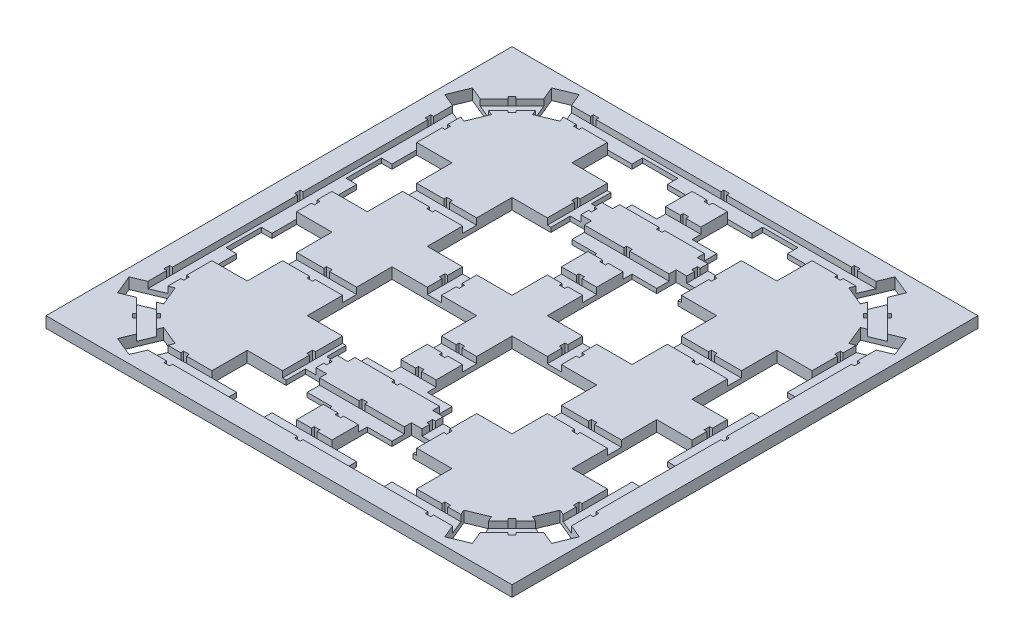
from build123d import *

# Parameters (mm, degrees)
SKETCH_1_W          = 660
SKETCH_1_H          = 660
EXTRUDE_1_DEPTH     = 15.5
SKETCH_2_W          = 150
SKETCH_2_H          = 37.5
SKETCH_2_W_2        = 185
SKETCH_2_H_2        = 150
SKETCH_2_H_3        = 50
CUT_EXTRUDE_1_DEPTH = 9
SKETCH_3_W          = 50
SKETCH_3_H          = 30
SKETCH_3_W_2        = 30
SKETCH_3_H_2        = 50
CUT_EXTRUDE_2_DEPTH = 467.947802222
SKETCH_4_W          = 50
SKETCH_4_H          = 120
SKETCH_4_W_2        = 120
SKETCH_4_H_2        = 50
CUT_EXTRUDE_3_DEPTH = 467.947802222
SKETCH_6_W          = 8
SKETCH_6_H          = 4
SKETCH_6_W_2        = 4
SKETCH_6_H_2        = 8
CUT_EXTRUDE_4_DEPTH = 467.947802222


with BuildPart() as part:
    # 草图1 → 凸台-拉伸1 (new body)
    with BuildSketch(Plane(origin=(0, 0, 0), x_dir=(1, 0, 0), z_dir=(0, 1, 0))):
        Rectangle(SKETCH_1_W, SKETCH_1_H)
    extrude(amount=EXTRUDE_1_DEPTH)

    # 草图2 → 切除-拉伸1 (cut)
    with BuildSketch(Plane(origin=(0, 15.5, 0), x_dir=(1, 0, 0), z_dir=(0, 1, 0))):
        Polygon((-300, 212), (-300, -232), (-232, -300), (232, -300), (300, -232), (300, 212), (300, 232), (232, 300), (212, 300), (-212, 300), (-232, 300), (-300, 232), align=None)
        Polygon((-280, 223.715728753), (-280, 95), (-95, 95), (-95, 280), (-223.715728753, 280), align=None, mode=Mode.SUBTRACT)
        Polygon((280, 223.715728753), (223.715728753, 280), (95, 280), (95, 95), (280, 95), align=None, mode=Mode.SUBTRACT)
        Polygon((280, -223.715728753), (223.715728753, -280), (95, -280), (95, -95), (280, -95), align=None, mode=Mode.SUBTRACT)
        Polygon((-223.715728753, -280), (-95, -280), (-95, -95), (-280, -95), (-280, -223.715728753), align=None, mode=Mode.SUBTRACT)
        with Locations((0, 261.25)):
            Rectangle(SKETCH_2_W, SKETCH_2_H, mode=Mode.SUBTRACT)
        with Locations((-187.5, 0)):
            Rectangle(SKETCH_2_W_2, SKETCH_2_H_2, mode=Mode.SUBTRACT)
        with Locations((0, 113.75)):
            Rectangle(SKETCH_2_W, SKETCH_2_H, mode=Mode.SUBTRACT)
        Rectangle(SKETCH_2_W, SKETCH_2_H_2, mode=Mode.SUBTRACT)
        with Locations((187.5, 0)):
            Rectangle(SKETCH_2_W_2, SKETCH_2_H_2, mode=Mode.SUBTRACT)
        with Locations((0, -113.75)):
            Rectangle(SKETCH_2_W, SKETCH_2_H, mode=Mode.SUBTRACT)
        with Locations((0, -261.25)):
            Rectangle(SKETCH_2_W, SKETCH_2_H, mode=Mode.SUBTRACT)
        with Locations((0, 187.5)):
            Rectangle(SKETCH_2_W, SKETCH_2_H_3, mode=Mode.SUBTRACT)
        with Locations((0, -187.5)):
            Rectangle(SKETCH_2_W, SKETCH_2_H_3, mode=Mode.SUBTRACT)
    extrude(amount=-CUT_EXTRUDE_1_DEPTH, mode=Mode.SUBTRACT)

    # 草图3 → 切除-拉伸2 (cut, through all)
    with BuildSketch(Plane(origin=(0, 15.5, 0), x_dir=(1, 0, 0), z_dir=(0, 1, 0))):
        Polygon((-251.283143173, 307.356736827), (-232.148971555, 261.162760202), (-204.432585579, 272.643263173), (-223.566757198, 318.837239798), align=None)
        with Locations((-85, 280)):
            Rectangle(SKETCH_3_W, SKETCH_3_H)
        with Locations((-280, 85)):
            Rectangle(SKETCH_3_W_2, SKETCH_3_H_2)
        with Locations((-85, 85)):
            Rectangle(SKETCH_3_W, SKETCH_3_H_2)
        Polygon((-261.162760202, 232.148971555), (-272.643263173, 204.432585579), (-318.837239798, 223.566757198), (-307.356736827, 251.283143173), align=None)
        with Locations((85, 85)):
            Rectangle(SKETCH_3_W, SKETCH_3_H_2)
        with Locations((85, 280)):
            Rectangle(SKETCH_3_W, SKETCH_3_H)
        Polygon((232.148971555, 261.162760202), (204.432585579, 272.643263173), (223.566757198, 318.837239798), (251.283143173, 307.356736827), align=None)
        Polygon((307.356736827, 251.283143173), (261.162760202, 232.148971555), (272.643263173, 204.432585579), (318.837239798, 223.566757198), align=None)
        with Locations((280, 85)):
            Rectangle(SKETCH_3_W_2, SKETCH_3_H_2)
        with Locations((280, -85)):
            Rectangle(SKETCH_3_W_2, SKETCH_3_H_2)
        Polygon((261.162760202, -232.148971555), (272.643263173, -204.432585579), (318.837239798, -223.566757198), (307.356736827, -251.283143173), align=None)
        Polygon((251.283143173, -307.356736827), (232.148971555, -261.162760202), (204.432585579, -272.643263173), (223.566757198, -318.837239798), align=None)
        with Locations((85, -280)):
            Rectangle(SKETCH_3_W, SKETCH_3_H)
        with Locations((85, -85)):
            Rectangle(SKETCH_3_W, SKETCH_3_H_2)
        Polygon((-307.356736827, -251.283143173), (-261.162760202, -232.148971555), (-272.643263173, -204.432585579), (-318.837239798, -223.566757198), align=None)
        with Locations((-280, -85)):
            Rectangle(SKETCH_3_W_2, SKETCH_3_H_2)
        with Locations((-85, -85)):
            Rectangle(SKETCH_3_W, SKETCH_3_H_2)
        with Locations((-85, -280)):
            Rectangle(SKETCH_3_W, SKETCH_3_H)
        Polygon((-223.566757198, -318.837239798), (-204.432585579, -272.643263173), (-232.148971555, -261.162760202), (-251.283143173, -307.356736827), align=None)
        with Locations((75, 227.5)):
            Rectangle(SKETCH_3_W_2, SKETCH_3_H_2)
        with Locations((-75, 227.5)):
            Rectangle(SKETCH_3_W_2, SKETCH_3_H_2)
        with Locations((75, -227.5)):
            Rectangle(SKETCH_3_W_2, SKETCH_3_H_2)
        with Locations((-75, -227.5)):
            Rectangle(SKETCH_3_W_2, SKETCH_3_H_2)
        with Locations((75, 147.5)):
            Rectangle(SKETCH_3_W_2, SKETCH_3_H_2)
        with Locations((-75, 147.5)):
            Rectangle(SKETCH_3_W_2, SKETCH_3_H_2)
        with Locations((75, -147.5)):
            Rectangle(SKETCH_3_W_2, SKETCH_3_H_2)
        with Locations((-75, -147.5)):
            Rectangle(SKETCH_3_W_2, SKETCH_3_H_2)
    extrude(amount=-CUT_EXTRUDE_2_DEPTH, mode=Mode.SUBTRACT)

    # 草图4 → 切除-拉伸3 (cut, through all)
    with BuildSketch(Plane(origin=(0, 15.5, 0), x_dir=(1, 0, 0), z_dir=(0, 1, 0))):
        with Locations((-255, 85)):
            Rectangle(SKETCH_4_W, SKETCH_4_H)
        with Locations((-85, 255)):
            Rectangle(SKETCH_4_W_2, SKETCH_4_H_2)
        with Locations((-85, 85)):
            Rectangle(SKETCH_4_W_2, SKETCH_4_H)
        with Locations((85, 85)):
            Rectangle(SKETCH_4_W_2, SKETCH_4_H)
        with Locations((85, 255)):
            Rectangle(SKETCH_4_W_2, SKETCH_4_H_2)
        with Locations((255, 85)):
            Rectangle(SKETCH_4_W, SKETCH_4_H)
        with Locations((255, -85)):
            Rectangle(SKETCH_4_W, SKETCH_4_H)
        with Locations((85, -255)):
            Rectangle(SKETCH_4_W_2, SKETCH_4_H_2)
        with Locations((85, -85)):
            Rectangle(SKETCH_4_W_2, SKETCH_4_H)
        with Locations((-85, -255)):
            Rectangle(SKETCH_4_W_2, SKETCH_4_H_2)
        with Locations((-85, -85)):
            Rectangle(SKETCH_4_W_2, SKETCH_4_H)
        with Locations((-255, -85)):
            Rectangle(SKETCH_4_W, SKETCH_4_H)
    extrude(amount=-CUT_EXTRUDE_3_DEPTH, mode=Mode.SUBTRACT)

    # 草图6 → 切除-拉伸4 (cut, through all)
    with BuildSketch(Plane(origin=(0, 15.5, 0), x_dir=(1, 0, 0), z_dir=(0, 1, 0))):
        with Locations((185, -302)):
            Rectangle(SKETCH_6_W, SKETCH_6_H)
        with Locations((278, -185)):
            Rectangle(SKETCH_6_W_2, SKETCH_6_H_2)
        with Locations((0, -302)):
            Rectangle(SKETCH_6_W, SKETCH_6_H)
        with Locations((0, -278)):
            Rectangle(SKETCH_6_W, SKETCH_6_H)
        with Locations((-185, -302)):
            Rectangle(SKETCH_6_W, SKETCH_6_H)
        with Locations((-185, -278)):
            Rectangle(SKETCH_6_W, SKETCH_6_H)
        Polygon((-251.857864376, -246.201010127), (-246.201010127, -251.857864376), (-249.029437252, -254.686291501), (-254.686291501, -249.029437252), align=None)
        Polygon((-268.828427125, -263.171572875), (-271.656854249, -266), (-266, -271.65685425), (-263.171572875, -268.828427125), align=None)
        with Locations((-302, -185)):
            Rectangle(SKETCH_6_W_2, SKETCH_6_H_2)
        with Locations((-97, -187.5)):
            Rectangle(SKETCH_6_W_2, SKETCH_6_H_2)
        with Locations((0, -210.5)):
            Rectangle(SKETCH_6_W, SKETCH_6_H)
        with Locations((0, -164.5)):
            Rectangle(SKETCH_6_W, SKETCH_6_H)
        with Locations((73, -187.5)):
            Rectangle(SKETCH_6_W_2, SKETCH_6_H_2)
        with Locations((97, -187.5)):
            Rectangle(SKETCH_6_W_2, SKETCH_6_H_2)
        with Locations((187.5, -97)):
            Rectangle(SKETCH_6_W, SKETCH_6_H)
        with Locations((187.5, -73)):
            Rectangle(SKETCH_6_W, SKETCH_6_H)
        with Locations((0, -130.5)):
            Rectangle(SKETCH_6_W, SKETCH_6_H)
        with Locations((0, -97)):
            Rectangle(SKETCH_6_W, SKETCH_6_H)
        with Locations((0, -73)):
            Rectangle(SKETCH_6_W, SKETCH_6_H)
        with Locations((-187.5, -97)):
            Rectangle(SKETCH_6_W, SKETCH_6_H)
        with Locations((-187.5, -73)):
            Rectangle(SKETCH_6_W, SKETCH_6_H)
        with Locations((302, 0)):
            Rectangle(SKETCH_6_W_2, SKETCH_6_H_2)
        with Locations((278, 0)):
            Rectangle(SKETCH_6_W_2, SKETCH_6_H_2)
        with Locations((97, 0)):
            Rectangle(SKETCH_6_W_2, SKETCH_6_H_2)
        with Locations((73, 0)):
            Rectangle(SKETCH_6_W_2, SKETCH_6_H_2)
        with Locations((-73, 0)):
            Rectangle(SKETCH_6_W_2, SKETCH_6_H_2)
        with Locations((-97, 0)):
            Rectangle(SKETCH_6_W_2, SKETCH_6_H_2)
        with Locations((-278, 0)):
            Rectangle(SKETCH_6_W_2, SKETCH_6_H_2)
        with Locations((-302, 0)):
            Rectangle(SKETCH_6_W_2, SKETCH_6_H_2)
        with Locations((187.5, 73)):
            Rectangle(SKETCH_6_W, SKETCH_6_H)
        with Locations((187.5, 97)):
            Rectangle(SKETCH_6_W, SKETCH_6_H)
        with Locations((0, 73)):
            Rectangle(SKETCH_6_W, SKETCH_6_H)
        with Locations((0, 97)):
            Rectangle(SKETCH_6_W, SKETCH_6_H)
        with Locations((-187.5, 73)):
            Rectangle(SKETCH_6_W, SKETCH_6_H)
        with Locations((-187.5, 97)):
            Rectangle(SKETCH_6_W, SKETCH_6_H)
        with Locations((0, 130.5)):
            Rectangle(SKETCH_6_W, SKETCH_6_H)
        with Locations((302, 185)):
            Rectangle(SKETCH_6_W_2, SKETCH_6_H_2)
        with Locations((278, 185)):
            Rectangle(SKETCH_6_W_2, SKETCH_6_H_2)
        Polygon((263.171572875, 268.828427125), (268.828427125, 263.171572875), (271.656854249, 266), (266, 271.656854249), align=None)
        Polygon((249.029437252, 254.686291501), (254.686291501, 249.029437252), (251.857864376, 246.201010127), (246.201010127, 251.857864376), align=None)
        with Locations((185, 278)):
            Rectangle(SKETCH_6_W, SKETCH_6_H)
        with Locations((185, 302)):
            Rectangle(SKETCH_6_W, SKETCH_6_H)
        with Locations((97, 187.5)):
            Rectangle(SKETCH_6_W_2, SKETCH_6_H_2)
        with Locations((73, 187.5)):
            Rectangle(SKETCH_6_W_2, SKETCH_6_H_2)
        with Locations((0, 210.5)):
            Rectangle(SKETCH_6_W, SKETCH_6_H)
        with Locations((0, 278)):
            Rectangle(SKETCH_6_W, SKETCH_6_H)
        with Locations((0, 302)):
            Rectangle(SKETCH_6_W, SKETCH_6_H)
        with Locations((-73, 187.5)):
            Rectangle(SKETCH_6_W_2, SKETCH_6_H_2)
        with Locations((-97, 187.5)):
            Rectangle(SKETCH_6_W_2, SKETCH_6_H_2)
        with Locations((-185, 278)):
            Rectangle(SKETCH_6_W, SKETCH_6_H)
        with Locations((-185, 302)):
            Rectangle(SKETCH_6_W, SKETCH_6_H)
        Polygon((-249.029437252, 254.686291501), (-246.201010127, 251.857864376), (-251.857864376, 246.201010127), (-254.686291501, 249.029437252), align=None)
        Polygon((-263.171572875, 268.828427125), (-268.828427125, 263.171572875), (-271.656854249, 266), (-266, 271.656854249), align=None)
        with Locations((-302, 185)):
            Rectangle(SKETCH_6_W_2, SKETCH_6_H_2)
        with Locations((-278, 185)):
            Rectangle(SKETCH_6_W_2, SKETCH_6_H_2)
        with Locations((185, -278)):
            Rectangle(SKETCH_6_W, SKETCH_6_H)
        Polygon((268.828427125, -263.171572875), (271.656854249, -266), (266, -271.656854249), (263.171572875, -268.828427125), align=None)
        Polygon((249.029437252, -254.686291501), (246.201010127, -251.857864376), (251.857864376, -246.201010127), (254.686291501, -249.029437252), align=None)
        with Locations((302, -185)):
            Rectangle(SKETCH_6_W_2, SKETCH_6_H_2)
        with Locations((0, -244.5)):
            Rectangle(SKETCH_6_W, SKETCH_6_H)
        with Locations((-278, -185)):
            Rectangle(SKETCH_6_W_2, SKETCH_6_H_2)
        with Locations((-73, -187.5)):
            Rectangle(SKETCH_6_W_2, SKETCH_6_H_2)
        with Locations((0, 164.5)):
            Rectangle(SKETCH_6_W, SKETCH_6_H)
        with Locations((0, 244.5)):
            Rectangle(SKETCH_6_W, SKETCH_6_H)
    extrude(amount=-CUT_EXTRUDE_4_DEPTH, mode=Mode.SUBTRACT)


solid = part.part
